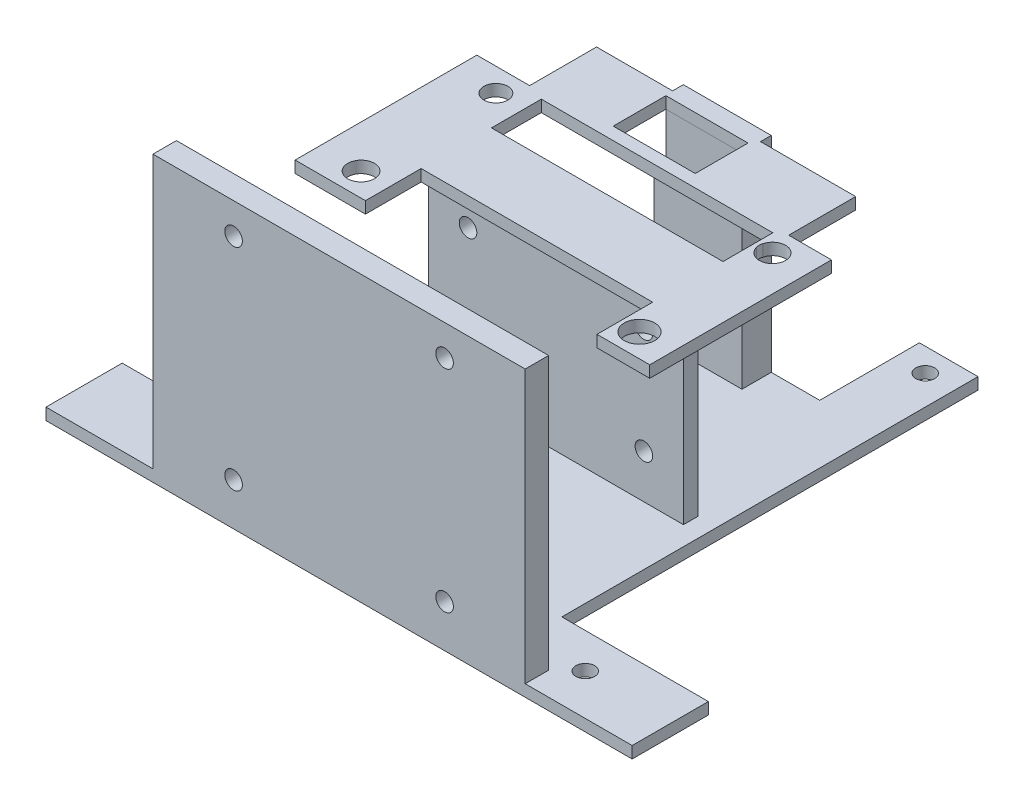
from build123d import *

# Parameters (mm, degrees)
SALIENTE_EXTRUIR1_DEPTH  = 2
CROQUIS2_W               = 30
CROQUIS2_H               = 17
CORTAR_EXTRUIR1_DEPTH    = 8
CROQUIS4_W               = 63.5
CROQUIS4_H               = 4
SALIENTE_EXTRUIR2_DEPTH  = 48.5
CROQUIS5_W               = 43.5
CROQUIS5_H               = 2.5
SALIENTE_EXTRUIR3_DEPTH  = 35
CROQUIS7_R               = 1.5
CORTAR_EXTRUIR2_DEPTH    = 9
CROQUIS8_R               = 1.5
CORTAR_EXTRUIR3_DEPTH    = 23
SALIENTE_EXTRUIR4_DEPTH  = 2
CROQUIS13_R              = 1.5
CORTAR_EXTRUIR4_DEPTH    = 2
CROQUIS16_W              = 3
CROQUIS16_H              = 31
SALIENTE_EXTRUIR7_DEPTH  = 2
CROQUIS17_W              = 15
CROQUIS17_H              = 3
SALIENTE_EXTRUIR8_DEPTH  = 25
CROQUIS21_W              = 15
CROQUIS21_H              = 3
SALIENTE_EXTRUIR9_DEPTH  = 2
CROQUIS25_R              = 3.826074219
CORTAR_EXTRUIR6_DEPTH    = 2
CROQUIS28_W              = 44.201296129
CROQUIS28_H              = 11.418561917
SALIENTE_EXTRUIR10_DEPTH = 2
CROQUIS30_W              = 15
CROQUIS30_H              = 3
SALIENTE_EXTRUIR11_DEPTH = 8
CROQUIS31_W              = 14
CROQUIS31_H              = 9
CORTAR_EXTRUIR7_DEPTH    = 2
CROQUIS33_W              = 39.5
CROQUIS33_H              = 1
SALIENTE_EXTRUIR13_DEPTH = 2
CROQUIS36_W              = 4.944902354
CROQUIS36_H              = 4.974433571
CROQUIS36_R              = 1.566702584
SALIENTE_EXTRUIR14_DEPTH = 2
CROQUIS37_R              = 2.242266835
CORTAR_EXTRUIR8_DEPTH    = 2
CROQUIS38_W              = 1.939564783
CROQUIS38_H              = 6.647351579
SALIENTE_EXTRUIR18_DEPTH = 2
CROQUIS39_R              = 2.608387943
CORTAR_EXTRUIR9_DEPTH    = 2
CROQUIS40_R              = 2.045540146
CORTAR_EXTRUIR10_DEPTH   = 2
CROQUIS41_R              = 2.280483158
CORTAR_EXTRUIR11_DEPTH   = 2
CROQUIS42_W              = 15
CROQUIS42_H              = 25
SALIENTE_EXTRUIR19_DEPTH = 5
CROQUIS43_R              = 1.6
CORTAR_EXTRUIR12_DEPTH   = 10


with BuildPart() as part:
    # Croquis1 → Saliente-Extruir1 (new body)
    with BuildSketch(Plane(origin=(0, 0, 0), x_dir=(1, 0, 0), z_dir=(0, 1, 0))):
        Polygon((25, 42), (-25, 42), (-25, -29), (-50, -29), (-50, -42), (50, -42), (50, -29), (25, -29), align=None)
    extrude(amount=SALIENTE_EXTRUIR1_DEPTH)

    # Croquis2 → Cortar-Extruir1 (cut)
    with BuildSketch(Plane(origin=(0, 0, 0), x_dir=(1, 0, 0), z_dir=(0, 1, 0))):
        with Locations((0, 33.5)):
            Rectangle(CROQUIS2_W, CROQUIS2_H)
    extrude(amount=CORTAR_EXTRUIR1_DEPTH, mode=Mode.SUBTRACT)

    # Croquis4 → Saliente-Extruir2 (add)
    with BuildSketch(Plane(origin=(0, 0, 0), x_dir=(1, 0, 0), z_dir=(0, 1, 0))):
        with Locations((0, -40)):
            Rectangle(CROQUIS4_W, CROQUIS4_H)
    extrude(amount=SALIENTE_EXTRUIR2_DEPTH)

    # Croquis5 → Saliente-Extruir3 (add)
    with BuildSketch(Plane(origin=(0, 0, 0), x_dir=(1, 0, 0), z_dir=(0, 1, 0))):
        with Locations((0, -3.75)):
            Rectangle(CROQUIS5_W, CROQUIS5_H)
    extrude(amount=SALIENTE_EXTRUIR3_DEPTH)

    # Croquis7 → Cortar-Extruir2 (cut, symmetric)
    with BuildSketch(Plane(origin=(0, 0, 38), x_dir=(-1, 0, 0), z_dir=(0, 0, -1))):
        with Locations(Location((-18, 43.25, 0), (0, 0, 180))):
            Circle(CROQUIS7_R)
        with Locations(Location((18, 43.25, 0), (0, 0, 180))):
            Circle(CROQUIS7_R)
        with Locations(Location((18, 7.25, 0), (0, 0, 180))):
            Circle(CROQUIS7_R)
        with Locations(Location((-18, 7.25, 0), (0, 0, 180))):
            Circle(CROQUIS7_R)
    extrude(amount=CORTAR_EXTRUIR2_DEPTH, both=True, mode=Mode.SUBTRACT)

    # Croquis8 → Cortar-Extruir3 (cut)
    with BuildSketch(Plane(origin=(0, 0, 2.5), x_dir=(-1, 0, 0), z_dir=(0, 0, -1))):
        with Locations((-15, 27.5)):
            Circle(CROQUIS8_R)
        with Locations((15, 9.5)):
            Circle(CROQUIS8_R)
        with Locations((15, 27.5)):
            Circle(CROQUIS8_R)
        with Locations((-15, 9.5)):
            Circle(CROQUIS8_R)
    extrude(amount=-CORTAR_EXTRUIR3_DEPTH, mode=Mode.SUBTRACT)



with BuildPart() as body_2:
    # Croquis12 → Saliente-Extruir4 (new body)
    with BuildSketch(Plane(origin=(0, 35, -35), x_dir=(1, 0, 0), z_dir=(0, -1, 0))):
        Polygon((21.25, 44.75), (-21.25, 44.75), (-21.25, 54.25), (-30.25, 54.25), (-30.25, 23.25), (-21.25, 23.25), (-21.25, 32.75), (21.25, 32.75), (21.25, 23.25), (30.25, 23.25), (30.25, 54.25), (21.25, 54.25), align=None)
    extrude(amount=-SALIENTE_EXTRUIR4_DEPTH)

    # Croquis13 → Cortar-Extruir4 (cut)
    with BuildSketch(Plane(origin=(0, 37, 0), x_dir=(1, 0, 0), z_dir=(0, 1, 0))):
        with Locations(Location((23, -15.25, 0), (0, 0, 270))):
            Circle(CROQUIS13_R)
        with Locations(Location((23, 7.75, 0), (0, 0, 90))):
            Circle(CROQUIS13_R)
        with Locations(Location((-23, 7.75, 0), (0, 0, 270))):
            Circle(CROQUIS13_R)
        with Locations(Location((-23, -15.25, 0), (0, 0, 90))):
            Circle(CROQUIS13_R)
    extrude(amount=-CORTAR_EXTRUIR4_DEPTH, mode=Mode.SUBTRACT)


with BuildPart() as part_1:
    add(part.part)

    add(body_2.part)  # Saliente-Extruir7 merges body 2
    # Croquis16 → Saliente-Extruir7 (add)
    with BuildSketch(Plane(origin=(0, 37, 0), x_dir=(1, 0, 0), z_dir=(0, 1, 0))):
        with Locations((-19.75, -3.75)):
            Rectangle(CROQUIS16_W, CROQUIS16_H)
    extrude(amount=-SALIENTE_EXTRUIR7_DEPTH)

    # Croquis17 → Saliente-Extruir8 (add)
    with BuildSketch(Plane(origin=(0, 2, 0), x_dir=(1, 0, 0), z_dir=(0, 1, 0))):
        with Locations((-0.769919921, 23.5)):
            Rectangle(CROQUIS17_W, CROQUIS17_H)
    extrude(amount=SALIENTE_EXTRUIR8_DEPTH)

    # Croquis21 → Saliente-Extruir9 (add)
    with BuildSketch(Plane(origin=(0, 27, 0), x_dir=(1, 0, 0), z_dir=(0, 1, 0))):
        with Locations((-0.769919921, 23.5)):
            Rectangle(CROQUIS21_W, CROQUIS21_H)
    extrude(amount=SALIENTE_EXTRUIR9_DEPTH)

    # Croquis25 → Cortar-Extruir6 (cut)
    with BuildSketch(Plane(origin=(0, 0, -25), x_dir=(-1, 0, 0), z_dir=(0, 0, -1))):
        with Locations((1.065680286, 20.360266958)):
            Circle(CROQUIS25_R)
    extrude(amount=-CORTAR_EXTRUIR6_DEPTH, mode=Mode.SUBTRACT)

    # Croquis28 → Saliente-Extruir10 (add)
    with BuildSketch(Plane(origin=(0, 37, 0), x_dir=(1, 0, 0), z_dir=(0, 1, 0))):
        with Locations((0.855508958, 17.459280959)):
            Rectangle(CROQUIS28_W, CROQUIS28_H)
    extrude(amount=-SALIENTE_EXTRUIR10_DEPTH)

    # Croquis30 → Saliente-Extruir11 (add)
    with BuildSketch(Plane(origin=(0, 37, 0), x_dir=(1, 0, 0), z_dir=(0, 1, 0))):
        with Locations((-0.769919921, 23.5)):
            Rectangle(CROQUIS30_W, CROQUIS30_H)
    extrude(amount=-SALIENTE_EXTRUIR11_DEPTH)

    # Croquis31 → Cortar-Extruir7 (cut)
    with BuildSketch(Plane(origin=(0, 37, 0), x_dir=(1, 0, 0), z_dir=(0, 1, 0))):
        with Locations((-1.129241311, 17.391372283)):
            Rectangle(CROQUIS31_W, CROQUIS31_H)
    extrude(amount=-CORTAR_EXTRUIR7_DEPTH, mode=Mode.SUBTRACT)

    # Croquis33 → Saliente-Extruir13 (add)
    with BuildSketch(Plane(origin=(0, 37, 0), x_dir=(1, 0, 0), z_dir=(0, 1, 0))):
        with Locations((1.5, 11.25)):
            Rectangle(CROQUIS33_W, CROQUIS33_H)
    extrude(amount=-SALIENTE_EXTRUIR13_DEPTH)

    # Croquis36 → Saliente-Extruir14 (add)
    with BuildSketch(Plane(origin=(0, 37, 0), x_dir=(1, 0, 0), z_dir=(0, 1, 0))):
        with Locations((23.722451177, 7.461073997)):
            Rectangle(CROQUIS36_W, CROQUIS36_H)
        with Locations((23.477387718, 7.75)):
            Circle(CROQUIS36_R, mode=Mode.SUBTRACT)
    extrude(amount=-SALIENTE_EXTRUIR14_DEPTH)

    # Croquis37 → Cortar-Extruir8 (cut)
    with BuildSketch(Plane(origin=(0, 37, 0), x_dir=(1, 0, 0), z_dir=(0, 1, 0))):
        with Locations((24.186288099, 7.75)):
            Circle(CROQUIS37_R)
    extrude(amount=-CORTAR_EXTRUIR8_DEPTH, mode=Mode.SUBTRACT)

    # Croquis38 → Saliente-Extruir18 (add)
    with BuildSketch(Plane(origin=(0, 37, 0), x_dir=(1, 0, 0), z_dir=(0, 1, 0))):
        with Locations((22.219782392, -15.926324211)):
            Rectangle(CROQUIS38_W, CROQUIS38_H)
    extrude(amount=-SALIENTE_EXTRUIR18_DEPTH)

    # Croquis39 → Cortar-Extruir9 (cut)
    with BuildSketch(Plane(origin=(0, 37, 0), x_dir=(1, 0, 0), z_dir=(0, 1, 0))):
        with Locations(Location((24.5, -15.25, 0), (0, 0, 270))):
            Circle(CROQUIS39_R)
    extrude(amount=-CORTAR_EXTRUIR9_DEPTH, mode=Mode.SUBTRACT)

    # Croquis40 → Cortar-Extruir10 (cut)
    with BuildSketch(Plane(origin=(0, 37, 0), x_dir=(1, 0, 0), z_dir=(0, 1, 0))):
        with Locations(Location((-23, 7.75, 0), (0, 0, 270))):
            Circle(CROQUIS40_R)
    extrude(amount=-CORTAR_EXTRUIR10_DEPTH, mode=Mode.SUBTRACT)

    # Croquis41 → Cortar-Extruir11 (cut)
    with BuildSketch(Plane(origin=(0, 37, 0), x_dir=(1, 0, 0), z_dir=(0, 1, 0))):
        with Locations(Location((-23, -15.25, 0), (0, 0, 270))):
            Circle(CROQUIS41_R)
    extrude(amount=-CORTAR_EXTRUIR11_DEPTH, mode=Mode.SUBTRACT)

    # Croquis42 → Saliente-Extruir19 (add)
    with BuildSketch(Plane(origin=(0, 0, -25), x_dir=(-1, 0, 0), z_dir=(0, 0, -1))):
        with Locations((0.769919921, 14.5)):
            Rectangle(CROQUIS42_W, CROQUIS42_H)
    extrude(amount=-SALIENTE_EXTRUIR19_DEPTH)

    # Croquis43 → Cortar-Extruir12 (cut)
    with BuildSketch(Plane(origin=(0, 2, 0), x_dir=(1, 0, 0), z_dir=(0, 1, 0))):
        with Locations(Location((-20, 38, 0), (0, 0, 270))):
            Circle(CROQUIS43_R)
        with Locations(Location((20, 38, 0), (0, 0, 270))):
            Circle(CROQUIS43_R)
        with Locations(Location((-35, -35, 0), (0, 0, 270))):
            Circle(CROQUIS43_R)
        with Locations(Location((35, -35, 0), (0, 0, 270))):
            Circle(CROQUIS43_R)
    extrude(amount=-CORTAR_EXTRUIR12_DEPTH, mode=Mode.SUBTRACT)


solid = part_1.part
